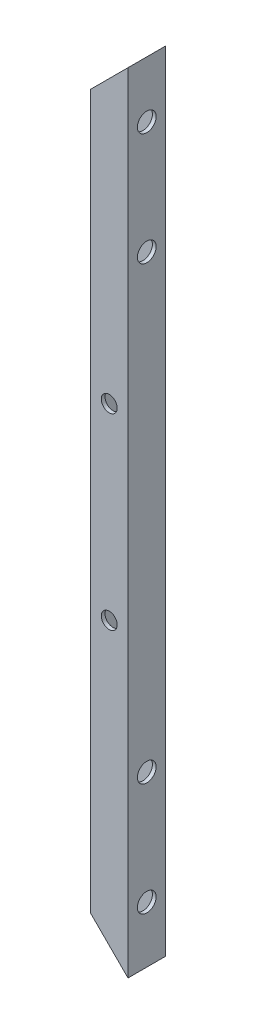
from build123d import *

# Parameters (mm, degrees)
SKETCH_1_W          = 10
SKETCH_1_H          = 10
SKETCH_1_W_2        = 8
SKETCH_1_H_2        = 8
EXTRUDE_1_DEPTH     = 210
CUT_EXTRUDE_3_DEPTH = 10
SKETCH_5_R          = 2.5
CUT_EXTRUDE_4_DEPTH = 10
SKETCH_11_R         = 2.125
CUT_EXTRUDE_6_DEPTH = 10


with BuildPart() as part:
    # 草图1 → 凸台-拉伸1 (new body)
    with BuildSketch(Plane(origin=(0, 0, 0), x_dir=(1, 0, 0), z_dir=(0, 1, 0))):
        Rectangle(SKETCH_1_W, SKETCH_1_H)
        Rectangle(SKETCH_1_W_2, SKETCH_1_H_2, mode=Mode.SUBTRACT)
    extrude(amount=EXTRUDE_1_DEPTH)

    # 草图4 → 切除-拉伸3 (cut)
    with BuildSketch(Plane(origin=(0, 0, -5), x_dir=(-1, 0, 0), z_dir=(0, 0, -1))):
        Polygon((-5, 210), (5, 200), (5, 210), align=None)
        Polygon((5, 0), (-5, 0), (5, 10), align=None)
    extrude(amount=-CUT_EXTRUDE_3_DEPTH, mode=Mode.SUBTRACT)

    # 草图5 → 切除-拉伸4 (cut)
    with BuildSketch(Plane.ZY.offset(5)):
        with Locations((0, 165)):
            Circle(SKETCH_5_R)
        with Locations(Location((0, 45, 0), (0, 0, 180))):
            Circle(SKETCH_5_R)
        with Locations((0, 195)):
            Circle(SKETCH_5_R)
        with Locations(Location((0, 15, 0), (0, 0, 180))):
            Circle(SKETCH_5_R)
    extrude(amount=-CUT_EXTRUDE_4_DEPTH, mode=Mode.SUBTRACT)

    # 草图11 → 切除-拉伸6 (cut)
    with BuildSketch(Plane.XY.offset(5)):
        with Locations((0, 130)):
            Circle(SKETCH_11_R)
        with Locations(Location((0, 80, 0), (0, 0, 180))):
            Circle(SKETCH_11_R)
    extrude(amount=-CUT_EXTRUDE_6_DEPTH, mode=Mode.SUBTRACT)


solid = part.part
